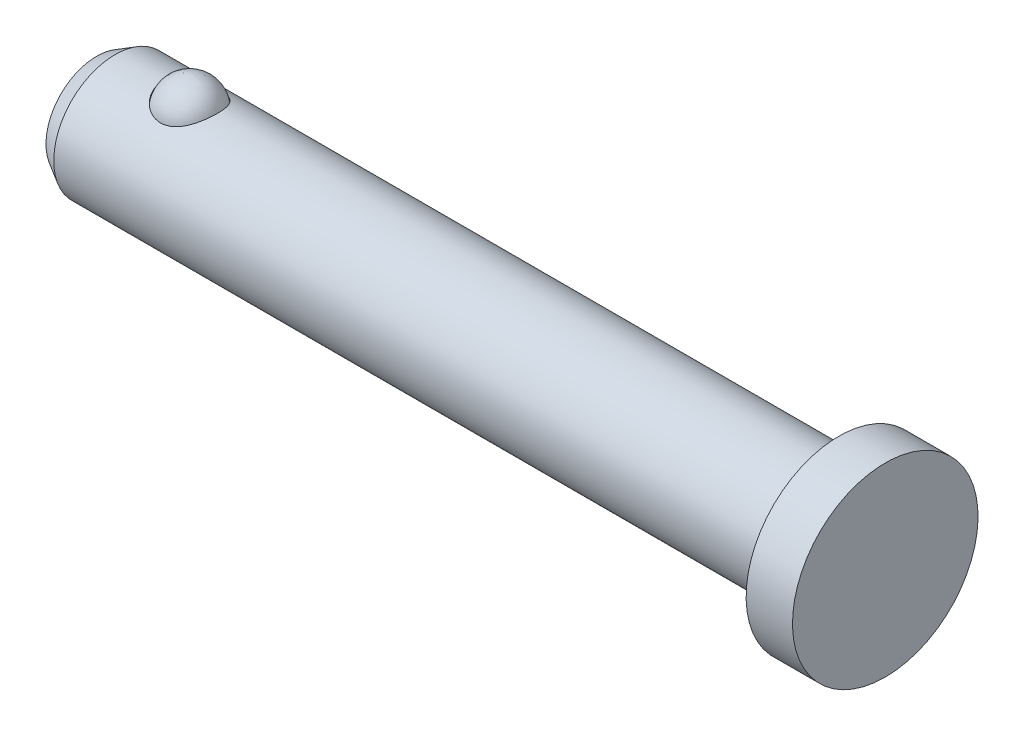
from build123d import *


with BuildPart() as part:
    # Sketch1 → Revolve1 (revolve)
    with BuildSketch(Plane.XY, mode=Mode.PRIVATE) as revolve1_sk:
        Polygon((20.240625, 4.7625), (17.859375, 4.7625), (17.859375, 3.1496), (-19.295745, 3.1496), (-20.240625, 2.604073278), (-20.240625, 0), (20.240625, 0), align=None)
    revolve(revolve1_sk.sketch.rotate(Axis((-20.240625, 0, 0), (1, 0, 0)), 180), axis=Axis((-20.240625, 0, 0), (1, 0, 0)))

    # Sketch2 → Cut-Revolve1 (revolve, cut)
    with BuildSketch(Plane.XY):
        with BuildLine():
            Line((-13.961791201, 2.636566201), (-16.969058799, 2.636566201))
            ThreePointArc((-16.969058799, 2.636566201), (-15.465425, 4.1402), (-13.961791201, 2.636566201))
        make_face()
    revolve(axis=Axis((-13.961791201, 2.636566201, 0), (1, 0, 0)), mode=Mode.SUBTRACT)


with BuildPart() as body_2:
    # Sketch3 → Revolve2 (revolve)
    with BuildSketch(Plane.XY):
        with BuildLine():
            Line((-13.987191201, 2.636566201), (-16.943658799, 2.636566201))
            ThreePointArc((-16.943658799, 2.636566201), (-15.465425, 4.1148), (-13.987191201, 2.636566201))
        make_face()
    revolve(axis=Axis((-13.987191201, 2.636566201, 0), (1, 0, 0)))


solid = Compound([part.part, body_2.part])
